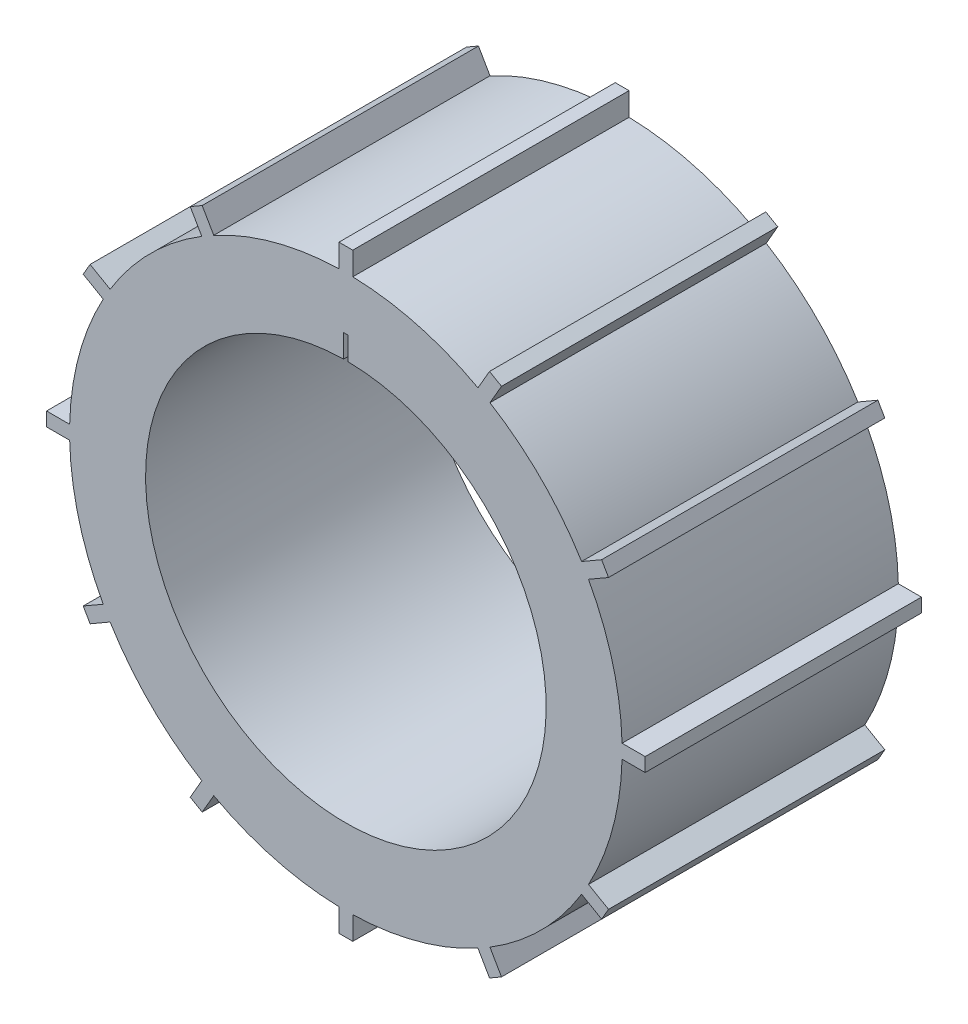
from build123d import *

# Parameters (mm, degrees)
SKETCH1_R           = 60
SKETCH1_R_2         = 43.5
EXTRUSION1_DEPTH    = 60
EXTRUSION3_START    = -60
EXTRUSION3_DEPTH    = 60
BOSS_EXTRUDE1_START = -60
BOSS_EXTRUDE1_DEPTH = 60


with BuildPart() as part:
    # Sketch1 → Extrusion1 (new body)
    with BuildSketch(Plane.XY):
        Circle(SKETCH1_R)
        Circle(SKETCH1_R_2, mode=Mode.SUBTRACT)
    extrude(amount=EXTRUSION1_DEPTH)

    # Sketch3 → Extrusion3 (cut)
    with BuildSketch(Plane.XY.offset(60).offset(EXTRUSION3_START)):
        with BuildLine():
            Line((-0.5, 48.5), (-0.5, 43.497126342))
            ThreePointArc((-0.5, 43.497126342), (0, 43.5), (0.5, 43.497126342))
            Line((0.5, 43.497126342), (0.5, 48.5))
            Line((0.5, 48.5), (-0.5, 48.5))
        make_face()
    extrude(amount=EXTRUSION3_DEPTH, mode=Mode.SUBTRACT)

    # Sketch4 → Boss-Extrude1 (add)
    with BuildSketch(Plane.XY.offset(60).offset(BOSS_EXTRUDE1_START)):
        with BuildLine():
            Line((31.28966164, 51.195283713), (31.299038106, 51.211524227))
            Line((31.299038106, 51.211524227), (33.799038106, 55.541651246))
            Line((33.799038106, 55.541651246), (31.200961894, 57.041651246))
            Line((31.200961894, 57.041651246), (28.700961894, 52.711524227))
            Line((28.700961894, 52.711524227), (28.691585429, 52.695283713))
            ThreePointArc((28.691585429, 52.695283713), (30, 51.961524227), (31.28966164, 51.195283713))
        make_face()
        with BuildLine():
            Line((1.5, 59.981247069), (1.5, 60))
            Line((1.5, 60), (1.5, 65))
            Line((1.5, 65), (-1.5, 65))
            Line((-1.5, 65), (-1.5, 60))
            Line((-1.5, 60), (-1.5, 59.981247069))
            ThreePointArc((-1.5, 59.981247069), (0, 60), (1.5, 59.981247069))
        make_face()
        with BuildLine():
            Line((52.695283713, 28.691585429), (52.711524227, 28.700961894))
            Line((52.711524227, 28.700961894), (57.041651246, 31.200961894))
            Line((57.041651246, 31.200961894), (55.541651246, 33.799038106))
            Line((55.541651246, 33.799038106), (51.211524227, 31.299038106))
            Line((51.211524227, 31.299038106), (51.195283713, 31.28966164))
            ThreePointArc((51.195283713, 31.28966164), (51.961524227, 30), (52.695283713, 28.691585429))
        make_face()
        with BuildLine():
            Line((59.981247069, -1.5), (60, -1.5))
            Line((60, -1.5), (65, -1.5))
            Line((65, -1.5), (65, 1.5))
            Line((65, 1.5), (60, 1.5))
            Line((60, 1.5), (59.981247069, 1.5))
            ThreePointArc((59.981247069, 1.5), (60, 0), (59.981247069, -1.5))
        make_face()
        with BuildLine():
            Line((51.195283713, -31.28966164), (51.211524227, -31.299038106))
            Line((51.211524227, -31.299038106), (55.541651246, -33.799038106))
            Line((55.541651246, -33.799038106), (57.041651246, -31.200961894))
            Line((57.041651246, -31.200961894), (52.711524227, -28.700961894))
            Line((52.711524227, -28.700961894), (52.695283713, -28.691585429))
            ThreePointArc((52.695283713, -28.691585429), (51.961524227, -30), (51.195283713, -31.28966164))
        make_face()
        with BuildLine():
            Line((28.691585429, -52.695283713), (28.700961894, -52.711524227))
            Line((28.700961894, -52.711524227), (31.200961894, -57.041651246))
            Line((31.200961894, -57.041651246), (33.799038106, -55.541651246))
            Line((33.799038106, -55.541651246), (31.299038106, -51.211524227))
            Line((31.299038106, -51.211524227), (31.28966164, -51.195283713))
            ThreePointArc((31.28966164, -51.195283713), (30, -51.961524227), (28.691585429, -52.695283713))
        make_face()
        with BuildLine():
            Line((-1.5, -59.981247069), (-1.5, -60))
            Line((-1.5, -60), (-1.5, -65))
            Line((-1.5, -65), (1.5, -65))
            Line((1.5, -65), (1.5, -60))
            Line((1.5, -60), (1.5, -59.981247069))
            ThreePointArc((1.5, -59.981247069), (0, -60), (-1.5, -59.981247069))
        make_face()
        with BuildLine():
            Line((-31.28966164, -51.195283713), (-31.299038106, -51.211524227))
            Line((-31.299038106, -51.211524227), (-33.799038106, -55.541651246))
            Line((-33.799038106, -55.541651246), (-31.200961894, -57.041651246))
            Line((-31.200961894, -57.041651246), (-28.700961894, -52.711524227))
            Line((-28.700961894, -52.711524227), (-28.691585429, -52.695283713))
            ThreePointArc((-28.691585429, -52.695283713), (-30, -51.961524227), (-31.28966164, -51.195283713))
        make_face()
        with BuildLine():
            Line((-52.695283713, -28.691585429), (-52.711524227, -28.700961894))
            Line((-52.711524227, -28.700961894), (-57.041651246, -31.200961894))
            Line((-57.041651246, -31.200961894), (-55.541651246, -33.799038106))
            Line((-55.541651246, -33.799038106), (-51.211524227, -31.299038106))
            Line((-51.211524227, -31.299038106), (-51.195283713, -31.28966164))
            ThreePointArc((-51.195283713, -31.28966164), (-51.961524227, -30), (-52.695283713, -28.691585429))
        make_face()
        with BuildLine():
            Line((-59.981247069, 1.5), (-60, 1.5))
            Line((-60, 1.5), (-65, 1.5))
            Line((-65, 1.5), (-65, -1.5))
            Line((-65, -1.5), (-60, -1.5))
            Line((-60, -1.5), (-59.981247069, -1.5))
            ThreePointArc((-59.981247069, -1.5), (-60, 0), (-59.981247069, 1.5))
        make_face()
        with BuildLine():
            Line((-51.195283713, 31.28966164), (-51.211524227, 31.299038106))
            Line((-51.211524227, 31.299038106), (-55.541651246, 33.799038106))
            Line((-55.541651246, 33.799038106), (-57.041651246, 31.200961894))
            Line((-57.041651246, 31.200961894), (-52.711524227, 28.700961894))
            Line((-52.711524227, 28.700961894), (-52.695283713, 28.691585429))
            ThreePointArc((-52.695283713, 28.691585429), (-51.961524227, 30), (-51.195283713, 31.28966164))
        make_face()
        with BuildLine():
            Line((-28.691585429, 52.695283713), (-28.700961894, 52.711524227))
            Line((-28.700961894, 52.711524227), (-31.200961894, 57.041651246))
            Line((-31.200961894, 57.041651246), (-33.799038106, 55.541651246))
            Line((-33.799038106, 55.541651246), (-31.299038106, 51.211524227))
            Line((-31.299038106, 51.211524227), (-31.28966164, 51.195283713))
            ThreePointArc((-31.28966164, 51.195283713), (-30, 51.961524227), (-28.691585429, 52.695283713))
        make_face()
    extrude(amount=BOSS_EXTRUDE1_DEPTH)


solid = part.part
